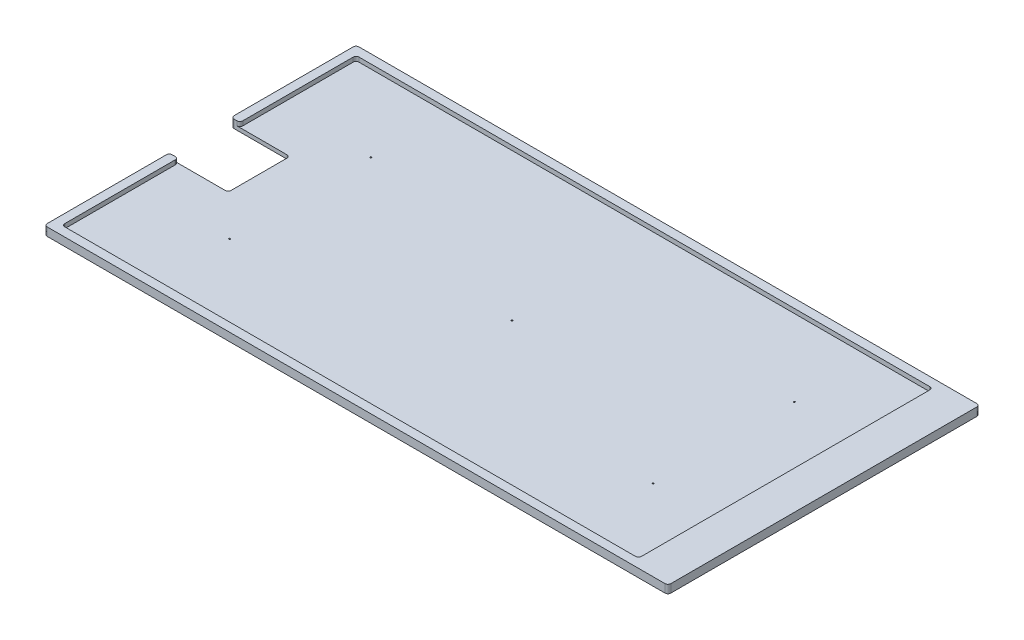
from build123d import *

# Parameters (mm, degrees)
SKETCH1_W                    = 1346.2
SKETCH1_H                    = 673.1
BOSS_EXTRUDE1_DEPTH          = 17.78
F_1_8_0_125_DIAMETER_HOLE1_D = 3.175
SKETCH4_W                    = 127
SKETCH4_H                    = 133.35
CUT_EXTRUDE1_DEPTH           = 753.758687031
SKETCH5_W                    = 1244.6
SKETCH5_H                    = 635
CUT_EXTRUDE2_DEPTH           = 9.525
FILLET1_R                    = 6.35


with BuildPart() as part:
    # Sketch1 → Boss-Extrude1 (new body)
    with BuildSketch(Plane(origin=(0, 0, 0), x_dir=(1, 0, 0), z_dir=(0, 1, 0))):
        Rectangle(SKETCH1_W, SKETCH1_H)
    extrude(amount=BOSS_EXTRUDE1_DEPTH)

    # 1/8 (0.125) Diameter Hole1 (through all)
    with Locations(Plane(origin=(0, 17.78, 0), x_dir=(1, 0, 0), z_dir=(0, 1, 0))):
        with Locations((0, 0), (457.2, 152.4), (-457.2, -152.4), (-457.2, 152.4), (457.2, -152.4)):
            Hole(F_1_8_0_125_DIAMETER_HOLE1_D / 2)

    # Sketch4 → Cut-Extrude1 (cut, through all)
    with BuildSketch(Plane(origin=(0, 17.78, 0), x_dir=(1, 0, 0), z_dir=(0, 1, 0))):
        with Locations((-609.6, 0)):
            Rectangle(SKETCH4_W, SKETCH4_H)
    extrude(amount=-CUT_EXTRUDE1_DEPTH, mode=Mode.SUBTRACT)

    # Sketch5 → Cut-Extrude2 (cut)
    with BuildSketch(Plane(origin=(0, 17.78, 0), x_dir=(1, 0, 0), z_dir=(0, 1, 0))):
        with Locations((-31.75, 0)):
            Rectangle(SKETCH5_W, SKETCH5_H)
    extrude(amount=-CUT_EXTRUDE2_DEPTH, mode=Mode.SUBTRACT)

    # Fillet1
    fillet1_edges = [part.edges().sort_by_distance(p)[0] for p in [
        (-673.1, 8.89, 66.675),
        (-673.1, 8.89, -66.675),
        (-546.1, 4.1275, -66.675),
        (-546.1, 4.1275, 66.675),
        (-654.05, 13.0175, 66.675),
        (-654.05, 13.0175, -66.675),
        (-654.05, 13.0175, 317.5),
        (590.55, 13.0175, -317.5),
        (673.1, 8.89, 336.55),
        (590.55, 13.0175, 317.5),
        (-673.1, 8.89, 336.55),
        (-654.05, 13.0175, -317.5),
        (-673.1, 8.89, -336.55),
        (673.1, 8.89, -336.55),
    ]]
    fillet(fillet1_edges, radius=FILLET1_R)


solid = part.part
